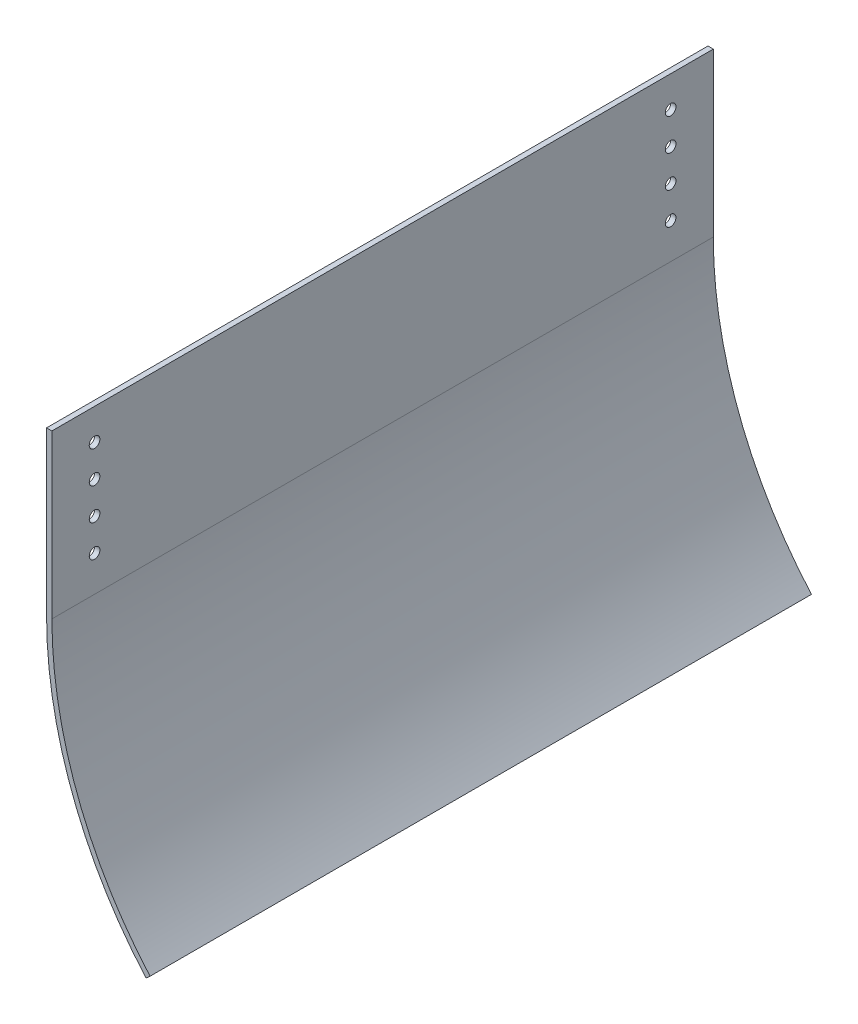
from build123d import *

# Parameters (mm, degrees)
BOSS_EXTRUDE1_DEPTH = 393.7
SKETCH2_R           = 3.175
CUT_EXTRUDE1_DEPTH  = 1537.708536769


with BuildPart() as part:
    # Sketch1 → Boss-Extrude1 (new body)
    with BuildSketch(Plane.XY):
        with BuildLine():
            Line((812.541689005, 1387.369803868), (812.541689005, 1484.270803868))
            Line((812.541689005, 1484.270803868), (815.716689005, 1484.270803868))
            Line((815.716689005, 1484.270803868), (815.716689005, 1387.369803868))
            ThreePointArc((815.716689005, 1387.369803868), (830.808178648, 1304.545262303), (874.142862637, 1232.366574946))
            Line((874.142862637, 1232.366574946), (871.757832535, 1230.270803868))
            ThreePointArc((871.757832535, 1230.270803868), (827.837227995, 1303.425406414), (812.541689005, 1387.369803868))
        make_face()
    extrude(amount=BOSS_EXTRUDE1_DEPTH)

    # Sketch2 → Cut-Extrude1 (cut, through all)
    with BuildSketch(Plane(origin=(815.716689005, 0, 0), x_dir=(0, 0, -1), z_dir=(1, 0, 0))):
        with Locations((-368.3, 1446.678803868)):
            Circle(SKETCH2_R)
        with Locations((-368.3, 1427.628803868)):
            Circle(SKETCH2_R)
        with Locations((-368.3, 1408.578803868)):
            Circle(SKETCH2_R)
        with Locations((-25.4, 1465.728803868)):
            Circle(SKETCH2_R)
        with Locations((-25.4, 1446.678803868)):
            Circle(SKETCH2_R)
        with Locations((-25.4, 1427.628803868)):
            Circle(SKETCH2_R)
        with Locations((-368.3, 1465.728803868)):
            Circle(SKETCH2_R)
        with Locations((-25.4, 1408.578803868)):
            Circle(SKETCH2_R)
    extrude(amount=-CUT_EXTRUDE1_DEPTH, mode=Mode.SUBTRACT)


solid = part.part
